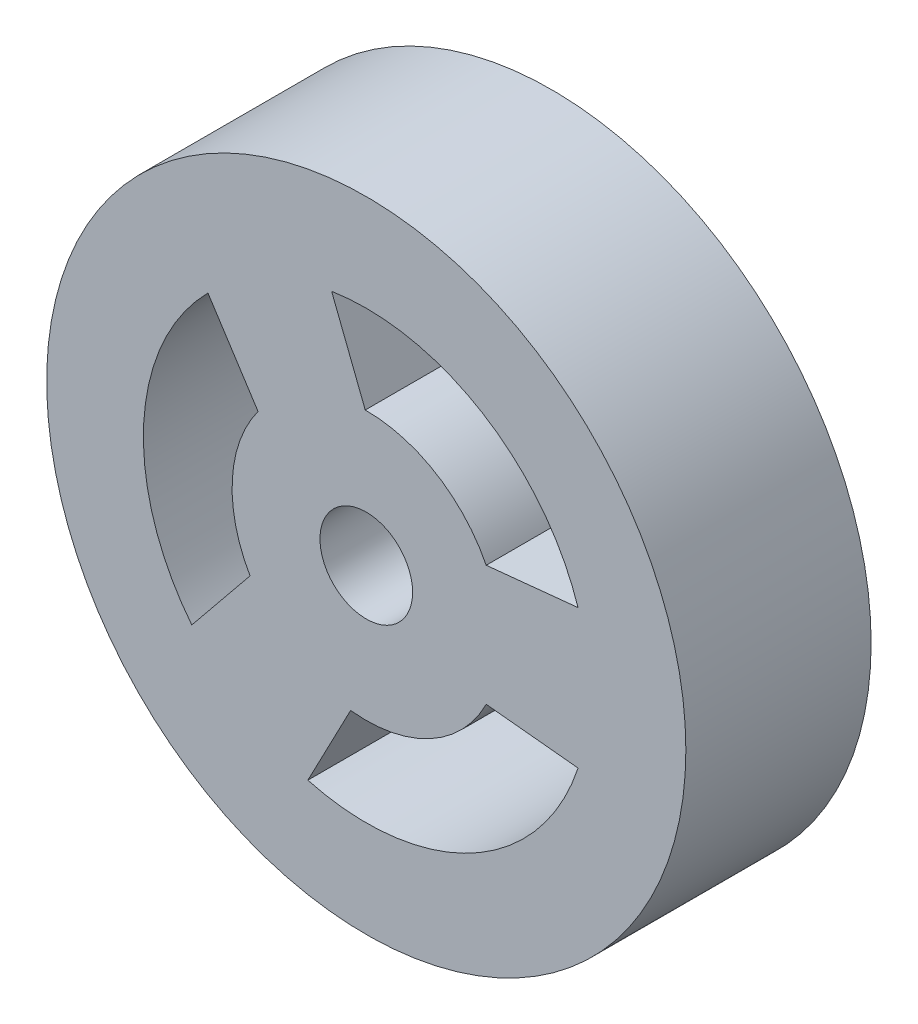
from build123d import *

# Parameters (mm, degrees)
SKETCH1_R          = 34.5
SKETCH1_R_2        = 5
BASE_EXTRUDE_DEPTH = 20


with BuildPart() as part:
    # Sketch1 → Base-Extrude (new body)
    with BuildSketch(Plane.XY):
        with Locations((255.493849666, -76.580612243)):
            Circle(SKETCH1_R)
        with Locations((255.493849666, -76.580612243)):
            Circle(SKETCH1_R_2, mode=Mode.SUBTRACT)
        with BuildLine():
            Line((268.439049892, -83.080585027), (278.355348881, -84.08056418))
            ThreePointArc((278.355348881, -84.08056418), (266.908732596, -97.760741447), (249.188294551, -99.799944708))
            Line((249.188294551, -99.799944708), (253.805371583, -90.9673039))
            ThreePointArc((253.805371583, -90.9673039), (262.366151463, -89.332056204), (268.439049892, -83.080585027))
        make_face(mode=Mode.SUBTRACT)
        with BuildLine():
            Line((242.946837579, -83.819420347), (236.659216854, -91.552386762))
            ThreePointArc((236.659216854, -91.552386762), (231.469396076, -75.2679603), (238.402528058, -59.645909673))
            Line((238.402528058, -59.645909673), (243.810204365, -68.0178856))
            ThreePointArc((243.810204365, -68.0178856), (241.029987303, -75.790333415), (242.946837579, -83.819420347))
        make_face(mode=Mode.SUBTRACT)
        with BuildLine():
            Line((251.755601813, -52.812504863), (255.382868286, -62.095601431))
            ThreePointArc((255.382868286, -62.095601431), (263.051568152, -64.223074204), (268.439022561, -70.080585027))
            Line((268.439022561, -70.080585027), (278.355317346, -69.08056418))
            ThreePointArc((278.355317346, -69.08056418), (268.047208684, -56.054760182), (251.755601813, -52.812504863))
        make_face(mode=Mode.SUBTRACT)
    extrude(amount=BASE_EXTRUDE_DEPTH)


solid = part.part
